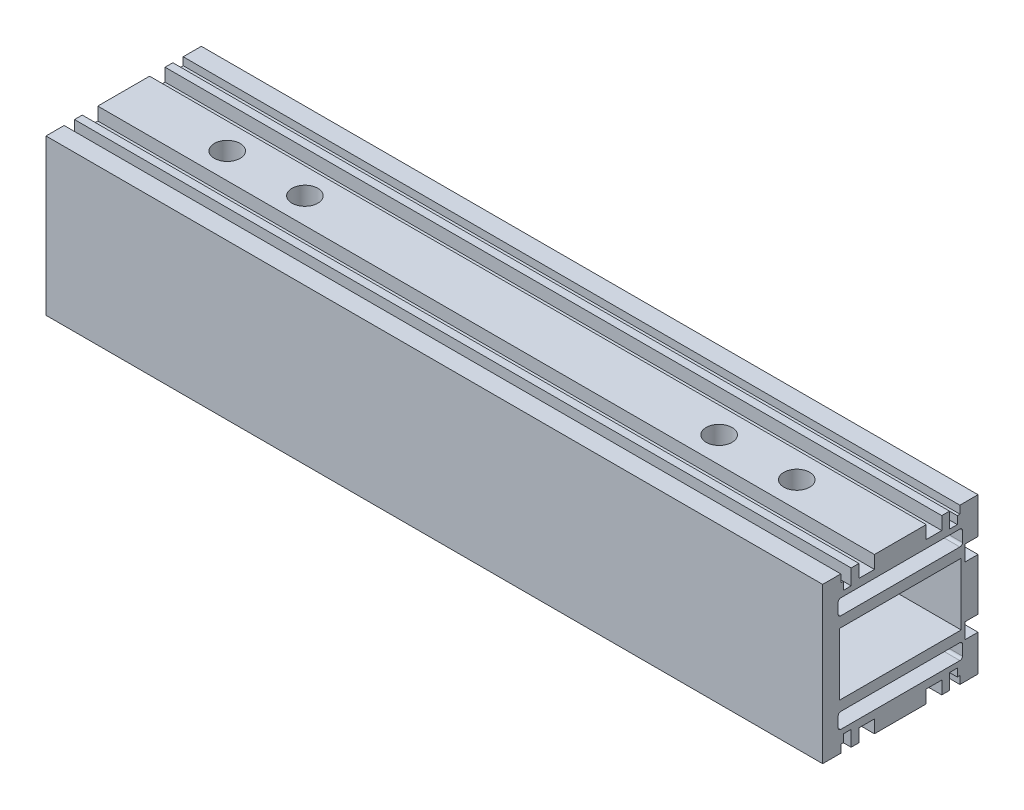
from build123d import *

# Parameters (mm, degrees)
SKETCH_1_W             = 23.5
SKETCH_1_H             = 12
EXTRUDE_1_DEPTH        = 75
HOLE_WIZARD_M6_1_D     = 5
HOLE_WIZARD_M6_1_DEPTH = 19
HOLE_WIZARD_M6_1_TIP   = 1.502151548
HOLE_WIZARD_M6_2_D     = 5
HOLE_WIZARD_M6_2_DEPTH = 19
HOLE_WIZARD_M6_2_TIP   = 1.502151548


with BuildPart() as part:
    # 草图1 → 凸台-拉伸1 (new, symmetric)
    with BuildSketch(Plane(origin=(0, 0, 0), x_dir=(0, 0, -1), z_dir=(1, 0, 0))):
        Polygon((-15, 15), (-11.5, 15), (-11.5, 13.5), (-11, 13.5), (-11, 12), (-9.5, 12), (-9.5, 15), (-8, 15), (-8, 12.5), (-5, 12.5), (-5, 15), (5, 15), (5, 12.5), (8, 12.5), (8, 15), (9.5, 15), (9.5, 12), (11, 12), (11, 13.5), (11.5, 13.5), (11.5, 15), (15, 15), (15, 8), (12.5, 8), (12.5, 5), (15, 5), (15, -5), (12.5, -5), (12.5, -8), (15, -8), (15, -15), (11.5, -15), (11.5, -13.5), (11, -13.5), (11, -12), (9.5, -12), (9.5, -15), (8, -15), (8, -12.5), (5, -12.5), (5, -15), (-5, -15), (-5, -12.5), (-8, -12.5), (-8, -15), (-9.5, -15), (-9.5, -12), (-11, -12), (-11, -13.5), (-11.5, -13.5), (-11.5, -15), (-15, -15), align=None)
        with BuildLine():
            Line((12, -10.5), (12, -8.5))
            ThreePointArc((12, -8.5), (11.853553391, -8.146446609), (11.5, -8))
            Line((11.5, -8), (-11.5, -8))
            ThreePointArc((-11.5, -8), (-11.853553391, -8.146446609), (-12, -8.5))
            Line((-12, -8.5), (-12, -10.5))
            ThreePointArc((-12, -10.5), (-11.853553391, -10.853553391), (-11.5, -11))
            Line((-11.5, -11), (11.5, -11))
            ThreePointArc((11.5, -11), (11.853553391, -10.853553391), (12, -10.5))
        make_face(mode=Mode.SUBTRACT)
        with BuildLine():
            Line((-11.5, 11), (11.5, 11))
            ThreePointArc((11.5, 11), (11.853553391, 10.853553391), (12, 10.5))
            Line((12, 10.5), (12, 8.5))
            ThreePointArc((12, 8.5), (11.853553391, 8.146446609), (11.5, 8))
            Line((11.5, 8), (-11.5, 8))
            ThreePointArc((-11.5, 8), (-11.853553391, 8.146446609), (-12, 8.5))
            Line((-12, 8.5), (-12, 10.5))
            ThreePointArc((-12, 10.5), (-11.853553391, 10.853553391), (-11.5, 11))
        make_face(mode=Mode.SUBTRACT)
        Rectangle(SKETCH_1_W, SKETCH_1_H, mode=Mode.SUBTRACT)
    extrude(amount=EXTRUDE_1_DEPTH, both=True)

    # M6 螺纹孔1
    with Locations(Plane(origin=(0, 15, 0), x_dir=(1, 0, 0), z_dir=(0, 1, 0))):
        with Locations((-40, 0), (-55, 0), (55, 0), (40, 0)):
            Hole(HOLE_WIZARD_M6_1_D / 2, depth=HOLE_WIZARD_M6_1_DEPTH)
            with Locations((0, 0, -(HOLE_WIZARD_M6_1_DEPTH + HOLE_WIZARD_M6_1_TIP / 2))):  # 118° drill point
                Cone(0, HOLE_WIZARD_M6_1_D / 2, HOLE_WIZARD_M6_1_TIP, mode=Mode.SUBTRACT)

    # M6 螺纹孔2
    with Locations(Plane(origin=(0, -15, 0), x_dir=(-1, 0, 0), z_dir=(0, -1, 0))):
        with Locations((-39, 0), (39, 0)):
            Hole(HOLE_WIZARD_M6_2_D / 2, depth=HOLE_WIZARD_M6_2_DEPTH)
            with Locations((0, 0, -(HOLE_WIZARD_M6_2_DEPTH + HOLE_WIZARD_M6_2_TIP / 2))):  # 118° drill point
                Cone(0, HOLE_WIZARD_M6_2_D / 2, HOLE_WIZARD_M6_2_TIP, mode=Mode.SUBTRACT)


solid = part.part
